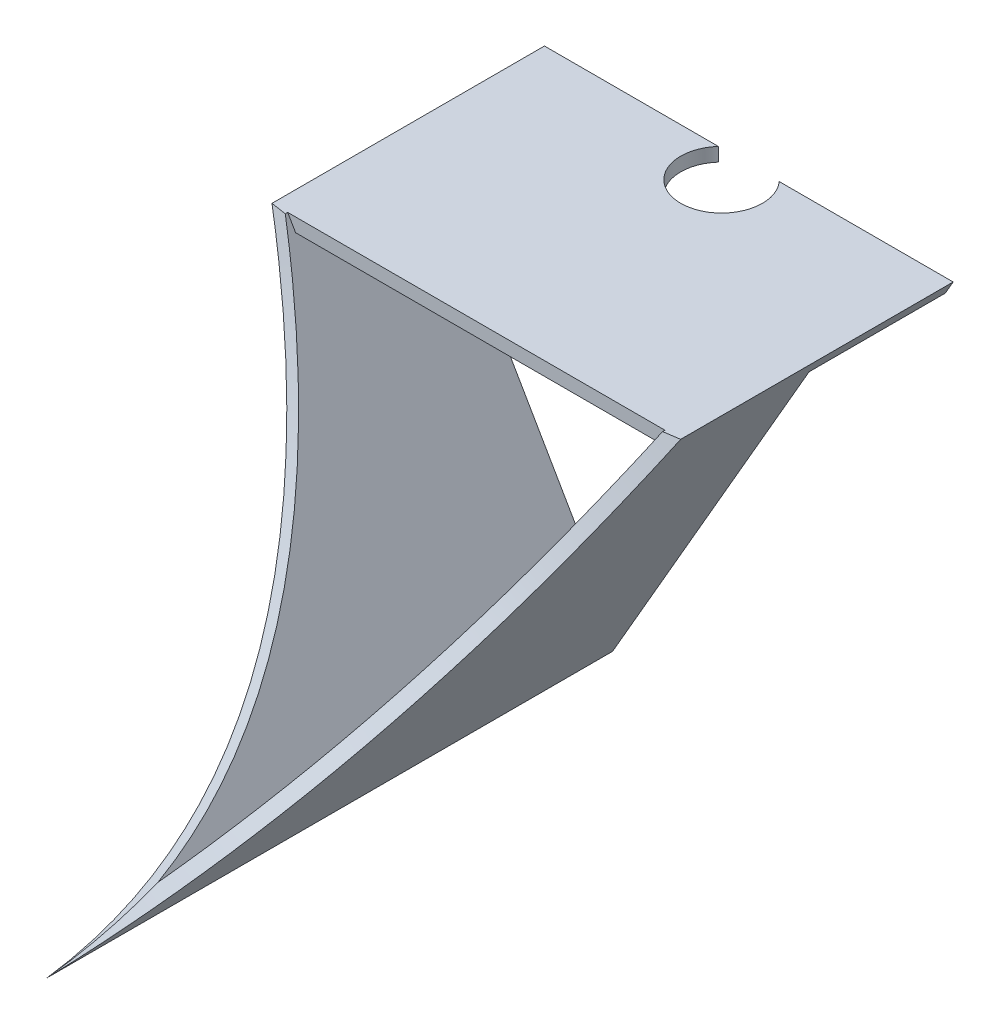
from build123d import *

# Parameters (mm, degrees)
BOSS_EXTRUDE1_DEPTH = 60
CUT_EXTRUDE2_DEPTH  = 1
CUT_EXTRUDE3_DEPTH  = 40
CUT_EXTRUDE4_DEPTH  = 10
SKETCH9_R           = 3
CUT_EXTRUDE5_DEPTH  = 1


with BuildPart() as part:
    # Sketch1 → Boss-Extrude1 (new body)
    with BuildSketch(Plane.XY):
        Polygon((-15, 1), (15, 1), (0, -24.980762114), align=None)
        Polygon((-13.267949192, 0), (13.267949192, 0), (0, -22.980762114), align=None, mode=Mode.SUBTRACT)
    extrude(amount=BOSS_EXTRUDE1_DEPTH)

    # Sketch4 → Cut-Extrude2 (cut)
    with BuildSketch(Plane(origin=(10.816987298, -6.245190528, 0), x_dir=(0, 0, -1), z_dir=(0.8660254037844365, -0.500000000000004, 0))):
        with BuildLine():
            Line((-60, 8.366025404), (-60, -21.633974596))
            add(Edge.make_bspline(
                [(-60, -21.633974596), (-29.886538221, -24.240664674), (-20, 8.366025404)],
                knots=[0, 0, 0, 1, 1, 1], degree=2))
            Line((-20, 8.366025404), (-60, 8.366025404))
        make_face()
    cut_extrude2 = extrude(amount=-CUT_EXTRUDE2_DEPTH, mode=Mode.SUBTRACT)

    # Mirror1: Cut-Extrude2 across plane
    add(cut_extrude2.mirror(Plane(origin=(0, 0, 0), x_dir=(0, 0, 1), z_dir=(1, 0, 0))), mode=Mode.SUBTRACT)

    # Sketch5 → Cut-Extrude3 (cut)
    with BuildSketch(Plane.XY.offset(60)):
        Polygon((-13.845299459, 0.999999995), (13.845299462, 1), (13.267949197, 8e-09), (-13.267949192, 0), align=None)
    extrude(amount=-CUT_EXTRUDE3_DEPTH, mode=Mode.SUBTRACT)

    # Sketch8 → Cut-Extrude4 (cut)
    with BuildSketch(Plane(origin=(0, 0, 0), x_dir=(-1, 0, 0), z_dir=(0, 0, -1))):
        Polygon((-15.872166784, 0), (15.872166784, 0), (0, -24.980762114), align=None)
    extrude(amount=-CUT_EXTRUDE4_DEPTH, mode=Mode.SUBTRACT)

    # Sketch9 → Cut-Extrude5 (cut)
    with BuildSketch(Plane(origin=(0, 1, 0), x_dir=(1, 0, 0), z_dir=(0, 1, 0))):
        with Locations((0, -2)):
            Circle(SKETCH9_R)
    extrude(amount=-CUT_EXTRUDE5_DEPTH, mode=Mode.SUBTRACT)


solid = part.part
